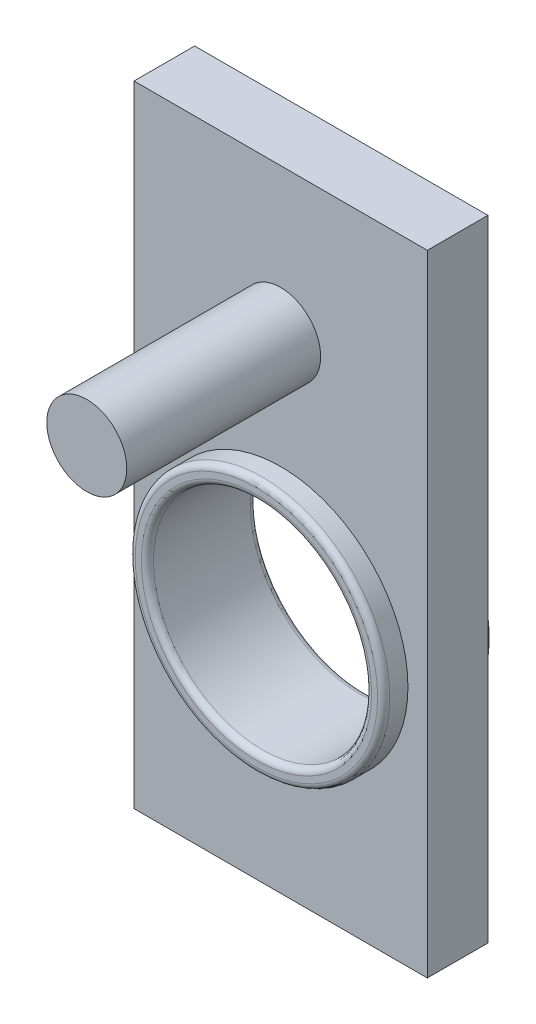
from build123d import *

# Parameters (mm, degrees)
SKETCH_1_W           = 12.1
SKETCH_1_H           = 26
SKETCH_1_R           = 4.5
EXTRUDE_1_DEPTH      = 2.5
SKETCH_2_R           = 1.65
EXTRUDE_2_DEPTH      = 8
EXTRUDE_3_DEPTH      = 1
EXTRUDE_3_DEPTH_BACK = 3.5
SKETCH_3_R           = 5.25
SKETCH_3_R_2         = 4.5
FILLET_1_R           = 0.25


with BuildPart() as part:
    # Эскиз1 → Вытянуть1 (new body)
    with BuildSketch(Plane.XY):
        with Locations((0, 3)):
            Rectangle(SKETCH_1_W, SKETCH_1_H)
        Circle(SKETCH_1_R, mode=Mode.SUBTRACT)
    extrude(amount=EXTRUDE_1_DEPTH)

    # Эскиз2 → Вытянуть2 (add)
    with BuildSketch(Plane.XY.offset(2.5)):
        with Locations(Location((0, 10, 0), (0, 0, 180))):
            Circle(SKETCH_2_R)
    extrude(amount=EXTRUDE_2_DEPTH)

    # Эскиз3 → Вытянуть3 (add, two sides: drawn at the far end of the back side and taken through both)
    with BuildSketch(Plane.XY.offset(2.5).offset(-EXTRUDE_3_DEPTH_BACK)):
        Circle(SKETCH_3_R)
        Circle(SKETCH_3_R_2, mode=Mode.SUBTRACT)
    extrude(amount=EXTRUDE_3_DEPTH + EXTRUDE_3_DEPTH_BACK)

    # Скругление1
    fillet_1_edges = [part.edges().sort_by_distance(p)[0] for p in [
        (-4.5, 0, 3.5),
        (-5.25, 0, -1),
        (-4.5, 0, -1),
        (-5.25, 0, 3.5),
    ]]
    fillet(fillet_1_edges, radius=FILLET_1_R)


solid = part.part
